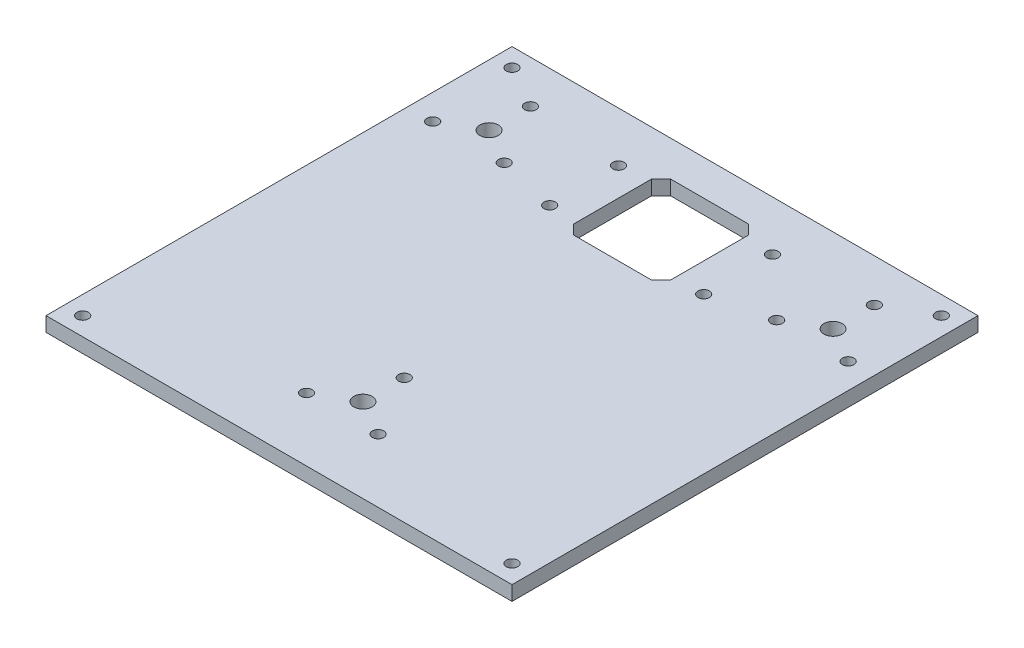
from build123d import *

# Parameters (mm, degrees)
ESQUISSE1_W             = 203.2
ESQUISSE1_H             = 203.2
BOSS_EXTRU_1_DEPTH      = 6.35
ESQUISSE2_R             = 4
ENL_V_MAT_EXTRU_1_DEPTH = 144.824345992
ENL_V_MAT_EXTRU_2_DEPTH = 144.824345992
ESQUISSE5_R             = 2.5
ENL_V_MAT_EXTRU_4_DEPTH = 144.824345992
ESQUISSE6_R             = 2.5
ENL_V_MAT_EXTRU_5_DEPTH = 144.824345992
ESQUISSE7_R             = 2.5
ENL_V_MAT_EXTRU_6_DEPTH = 144.824345992


with BuildPart() as part:
    # Esquisse1 → Boss.-Extru.1 (new body)
    with BuildSketch(Plane(origin=(0, 0, 0), x_dir=(1, 0, 0), z_dir=(0, 1, 0))):
        Rectangle(ESQUISSE1_W, ESQUISSE1_H)
    extrude(amount=BOSS_EXTRU_1_DEPTH)

    # Esquisse2 → Enlèv. mat.-Extru.1 (cut, through all)
    with BuildSketch(Plane(origin=(0, 6.35, 0), x_dir=(1, 0, 0), z_dir=(0, 1, 0))):
        with Locations(Location((-75, 65, 0), (0, 0, 270))):
            Circle(ESQUISSE2_R)
        with Locations(Location((75, 65, 0), (0, 0, 270))):
            Circle(ESQUISSE2_R)
        with Locations(Location((0, -65, 0), (0, 0, 270))):
            Circle(ESQUISSE2_R)
    extrude(amount=-ENL_V_MAT_EXTRU_1_DEPTH, mode=Mode.SUBTRACT)

    # Esquisse3 → Enlèv. mat.-Extru.2 (cut, through all)
    with BuildSketch(Plane(origin=(0, 6.35, 0), x_dir=(1, 0, 0), z_dir=(0, 1, 0))):
        Polygon((-17.05, 86.15), (-21.15, 82.05), (-21.15, 47.95), (-17.05, 43.85), (17.05, 43.85), (21.15, 47.95), (21.15, 82.05), (17.05, 86.15), align=None)
    extrude(amount=-ENL_V_MAT_EXTRU_2_DEPTH, mode=Mode.SUBTRACT)

    # Esquisse5 → Enlèv. mat.-Extru.4 (cut, through all)
    with BuildSketch(Plane(origin=(0, 6.35, 0), x_dir=(1, 0, 0), z_dir=(0, 1, 0))):
        with Locations(Location((-33.425, 49.85, 0), (0, 0, 270))):
            Circle(ESQUISSE5_R)
        with Locations(Location((-33.425, 79.85, 0), (0, 0, 270))):
            Circle(ESQUISSE5_R)
        with Locations(Location((33.725, 49.85, 0), (0, 0, 270))):
            Circle(ESQUISSE5_R)
        with Locations(Location((33.725, 79.85, 0), (0, 0, 270))):
            Circle(ESQUISSE5_R)
    extrude(amount=-ENL_V_MAT_EXTRU_4_DEPTH, mode=Mode.SUBTRACT)

    # Esquisse6 → Enlèv. mat.-Extru.5 (cut, through all)
    with BuildSketch(Plane(origin=(0, 6.35, 0), x_dir=(1, 0, 0), z_dir=(0, 1, 0))):
        with Locations(Location((93.6, -93.6, 0), (0, 0, 270))):
            Circle(ESQUISSE6_R)
        with Locations(Location((-93.6, -93.6, 0), (0, 0, 270))):
            Circle(ESQUISSE6_R)
        with Locations(Location((-93.6, 93.6, 0), (0, 0, 270))):
            Circle(ESQUISSE6_R)
        with Locations(Location((93.6, 93.6, 0), (0, 0, 270))):
            Circle(ESQUISSE6_R)
    extrude(amount=-ENL_V_MAT_EXTRU_5_DEPTH, mode=Mode.SUBTRACT)

    # Esquisse7 → Enlèv. mat.-Extru.6 (cut, through all)
    with BuildSketch(Plane(origin=(0, 6.35, 0), x_dir=(1, 0, 0), z_dir=(0, 1, 0))):
        with Locations(Location((-15.588457268, -74, 0), (0, 0, 270))):
            Circle(ESQUISSE7_R)
        with Locations(Location((15.588457268, -74, 0), (0, 0, 270))):
            Circle(ESQUISSE7_R)
        with Locations(Location((0, -47, 0), (0, 0, 270))):
            Circle(ESQUISSE7_R)
        with Locations(Location((90.588457268, 56, 0), (0, 0, 270))):
            Circle(ESQUISSE7_R)
        with Locations(Location((59.411542732, 56, 0), (0, 0, 270))):
            Circle(ESQUISSE7_R)
        with Locations(Location((75, 83, 0), (0, 0, 270))):
            Circle(ESQUISSE7_R)
        with Locations(Location((-90.588457268, 56, 0), (0, 0, 270))):
            Circle(ESQUISSE7_R)
        with Locations(Location((-59.411542732, 56, 0), (0, 0, 270))):
            Circle(ESQUISSE7_R)
        with Locations(Location((-75, 83, 0), (0, 0, 270))):
            Circle(ESQUISSE7_R)
    extrude(amount=-ENL_V_MAT_EXTRU_6_DEPTH, mode=Mode.SUBTRACT)


solid = part.part
